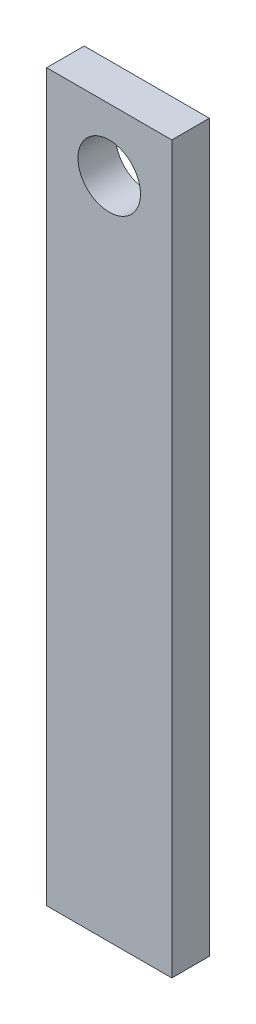
from build123d import *

# Parameters (mm, degrees)
SKETCH_1_W      = 10
SKETCH_1_H      = 58
SKETCH_1_R      = 2.5
EXTRUDE_1_DEPTH = 3


with BuildPart() as part:
    # 草圖1 → 填料-伸長1 (new body)
    with BuildSketch(Plane.XY):
        Rectangle(SKETCH_1_W, SKETCH_1_H)
        with Locations((0, 24)):
            Circle(SKETCH_1_R, mode=Mode.SUBTRACT)
    extrude(amount=EXTRUDE_1_DEPTH)


solid = part.part
